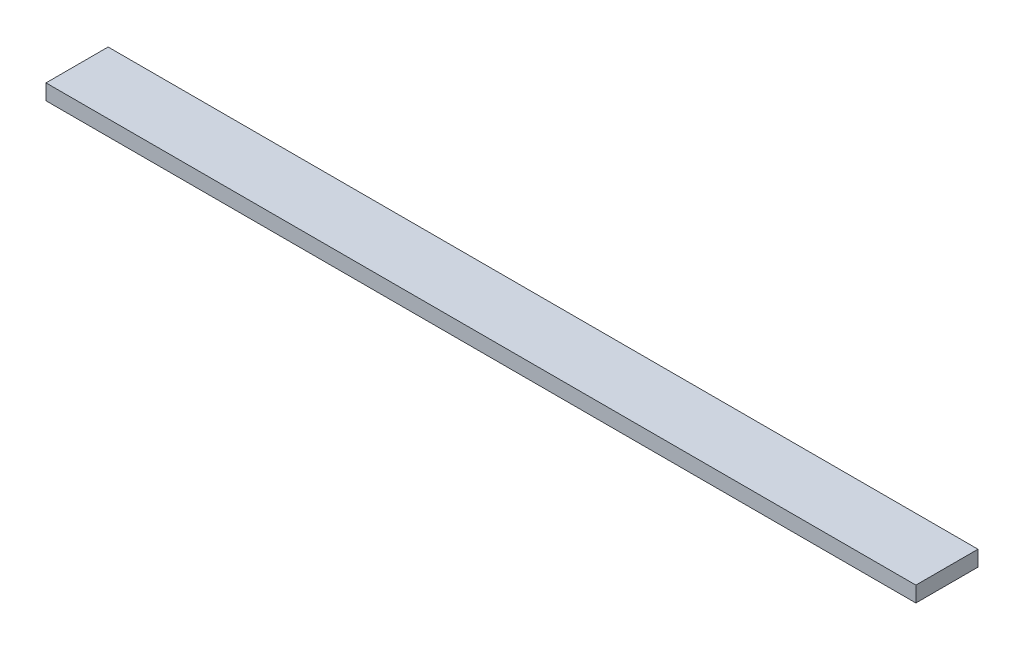
from build123d import *

# Parameters (mm, degrees)
SKETCH1_W           = 177.8
SKETCH1_H           = 12.7
BOSS_EXTRUDE1_DEPTH = 3.175


with BuildPart() as part:
    # Sketch1 → Boss-Extrude1 (new body)
    with BuildSketch(Plane(origin=(0, 0, 0), x_dir=(1, 0, 0), z_dir=(0, 1, 0))):
        with Locations((88.9, 6.35)):
            Rectangle(SKETCH1_W, SKETCH1_H)
    extrude(amount=BOSS_EXTRUDE1_DEPTH)


solid = part.part
